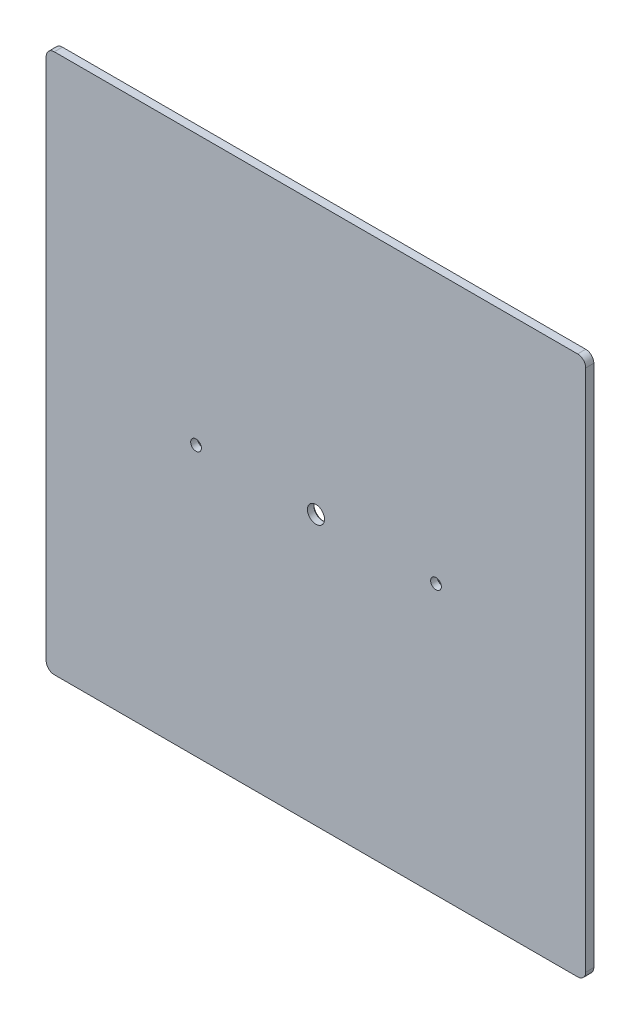
from build123d import *

# Parameters (mm, degrees)
BASEPLATE_W                   = 200
BASEPLATE_H                   = 200
BOSS_EXTRUDE1_DEPTH           = 3
FILLET1_R                     = 3
F_5_32_DOWEL_HOLE_D           = 3.96875
F_5_32_DOWEL_HOLE_CSINK_D     = 5.23875
F_5_32_DOWEL_HOLE_CSINK_ANGLE = 100


with BuildPart() as part:
    # Baseplate → Boss-Extrude1 (new body)
    with BuildSketch(Plane.XY):
        Rectangle(BASEPLATE_W, BASEPLATE_H)
    extrude(amount=BOSS_EXTRUDE1_DEPTH)

    # Fillet1
    fillet1_edges = [part.edges().sort_by_distance(p)[0] for p in [
        (100, -100, 1.5),
        (-100, -100, 1.5),
        (-100, 100, 1.5),
        (100, 100, 1.5),
    ]]
    fillet(fillet1_edges, radius=FILLET1_R)

    # Sketch8 → 1/4 Inch Bolt Hole (revolve, cut)
    with BuildSketch(Plane.YZ):
        Polygon((0, 0), (0, 3), (3.175, 3), (3.175, 0.635), (3.81, 0), align=None)
    revolve(axis=Axis((0, 0, -6.35), (0, 0, 1)), mode=Mode.SUBTRACT)

    # 5/32 Dowel Hole (through all)
    with Locations(Plane(origin=(0, 0, 0), x_dir=(-1, 0, 0), z_dir=(0, 0, -1))):
        with Locations((-44.5, 0), (44.45, 0)):
            CounterSinkHole(F_5_32_DOWEL_HOLE_D / 2, F_5_32_DOWEL_HOLE_CSINK_D / 2, counter_sink_angle=F_5_32_DOWEL_HOLE_CSINK_ANGLE)


solid = part.part
